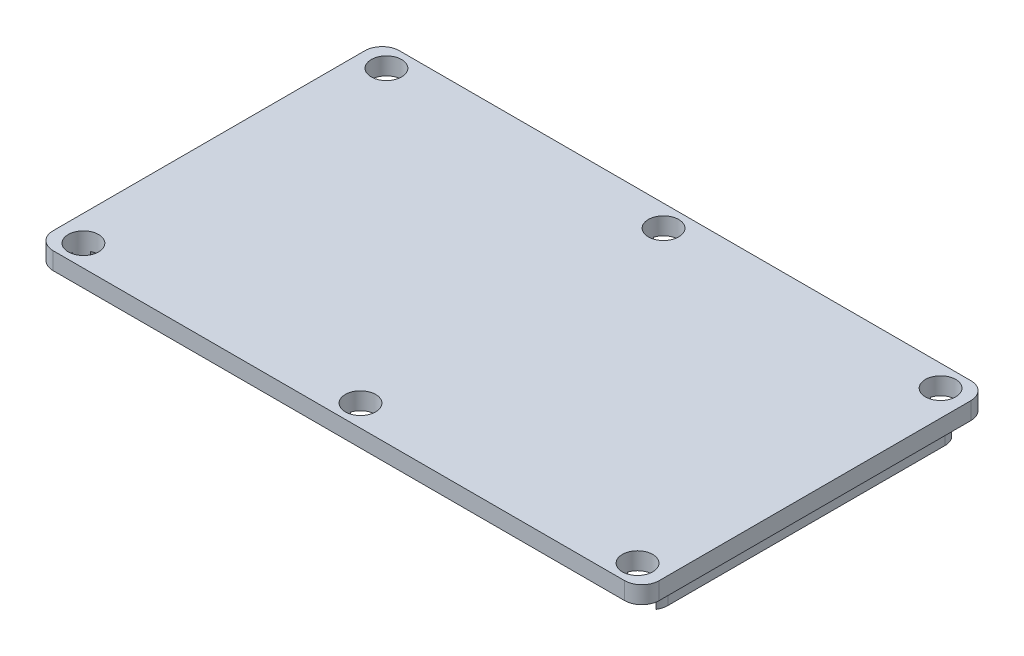
from build123d import *

# Parameters (mm, degrees)
BOSS_EXTRUDE1_DEPTH = 2
BOSS_EXTRUDE2_DEPTH = 2
SKETCH3_R           = 1.75
CUT_EXTRUDE1_DEPTH  = 10


with BuildPart() as part:
    # Sketch1 → Boss-Extrude1 (new body)
    with BuildSketch(Plane(origin=(0, 0, 0), x_dir=(1, 0, 0), z_dir=(0, 1, 0))):
        with BuildLine():
            Line((-33, -20), (33, -20))
            ThreePointArc((33, -20), (34.414213562, -19.414213562), (35, -18))
            Line((35, -18), (35, 18))
            ThreePointArc((35, 18), (34.414213562, 19.414213562), (33, 20))
            Line((33, 20), (-33, 20))
            ThreePointArc((-33, 20), (-34.414213562, 19.414213562), (-35, 18))
            Line((-35, 18), (-35, -18))
            ThreePointArc((-35, -18), (-34.414213562, -19.414213562), (-33, -20))
        make_face()
    extrude(amount=BOSS_EXTRUDE1_DEPTH)

    # Sketch2 → Boss-Extrude2 (add)
    with BuildSketch(Plane.XZ):
        with BuildLine():
            Line((-32, 18), (32, 18))
            ThreePointArc((32, 18), (33.414213562, 17.414213562), (34, 16))
            Line((34, 16), (34, -16))
            ThreePointArc((34, -16), (33.414213562, -17.414213562), (32, -18))
            Line((32, -18), (-32, -18))
            ThreePointArc((-32, -18), (-33.414213562, -17.414213562), (-34, -16))
            Line((-34, -16), (-34, 16))
            ThreePointArc((-34, 16), (-33.414213562, 17.414213562), (-32, 18))
        make_face()
        with BuildLine():
            Line((-31, 17), (31, 17))
            ThreePointArc((31, 17), (32.414213562, 16.414213562), (33, 15))
            Line((33, 15), (33, -15))
            ThreePointArc((33, -15), (32.414213562, -16.414213562), (31, -17))
            Line((31, -17), (-31, -17))
            ThreePointArc((-31, -17), (-32.414213562, -16.414213562), (-33, -15))
            Line((-33, -15), (-33, 15))
            ThreePointArc((-33, 15), (-32.414213562, 16.414213562), (-31, 17))
        make_face(mode=Mode.SUBTRACT)
    extrude(amount=BOSS_EXTRUDE2_DEPTH)

    # Sketch3 → Cut-Extrude1 (cut)
    with BuildSketch(Plane(origin=(0, 2, 0), x_dir=(1, 0, 0), z_dir=(0, 1, 0))):
        with Locations(Location((-32, 17.5, 0), (0, 0, 270))):
            Circle(SKETCH3_R)
        with Locations(Location((0, 17.5, 0), (0, 0, 270))):
            Circle(SKETCH3_R)
        with Locations(Location((32, 17.5, 0), (0, 0, 270))):
            Circle(SKETCH3_R)
        with Locations(Location((32, -17.5, 0), (0, 0, 270))):
            Circle(SKETCH3_R)
        with Locations(Location((0, -17.5, 0), (0, 0, 270))):
            Circle(SKETCH3_R)
        with Locations(Location((-32, -17.5, 0), (0, 0, 270))):
            Circle(SKETCH3_R)
    extrude(amount=-CUT_EXTRUDE1_DEPTH, mode=Mode.SUBTRACT)


solid = part.part
